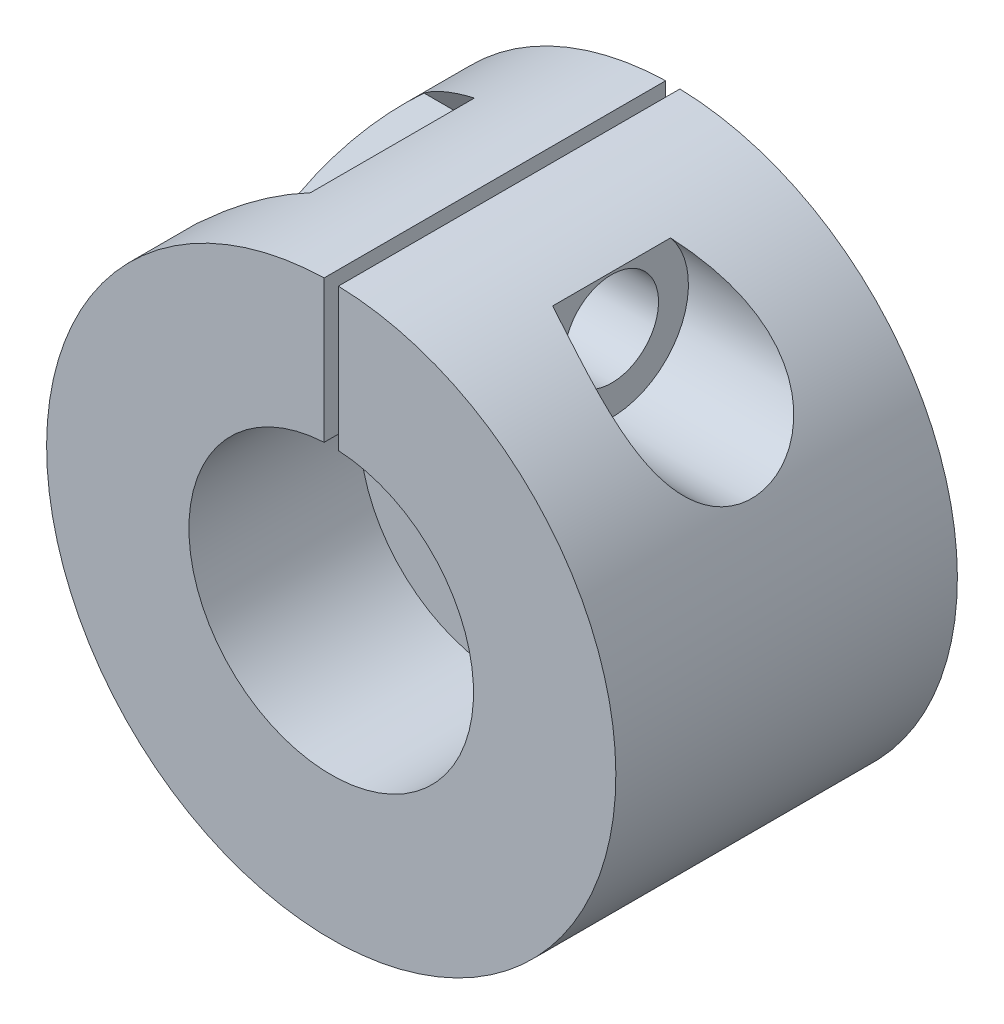
from build123d import *

# Parameters (mm, degrees)
SKETCH1_R               = 12.7
BOSS_EXTRUDE1_DEPTH     = 15.24
SKETCH2_R               = 2.9845
CUT_EXTRUDE1_DEPTH      = 7.62
SKETCH3_R               = 6.35
CUT_EXTRUDE2_DEPTH      = 7.62
CUT_EXTRUDE3_REACH      = 25.555
SKETCH7_W               = 0.635
SKETCH7_H               = 13.97
CUT_EXTRUDE4_DEPTH      = 24.727682277
CUT_EXTRUDE4_DEPTH_BACK = 24.727682277
SKETCH8_R               = 2.0955
SKETCH9_R               = 3.429
CUT_EXTRUDE5_DEPTH      = 7.62
CUT_EXTRUDE6_DEPTH      = 27.512980205


with BuildPart() as part:
    # Sketch1 → Boss-Extrude1 (new body)
    with BuildSketch(Plane.XY):
        with Locations(Location((0, 0, 0), (0, 0, 180))):
            Circle(SKETCH1_R)
    extrude(amount=BOSS_EXTRUDE1_DEPTH)

    # Sketch2 → Cut-Extrude1 (cut)
    with BuildSketch(Plane(origin=(0, 0, 0), x_dir=(-1, 0, 0), z_dir=(0, 0, -1))):
        Circle(SKETCH2_R)
    extrude(amount=-CUT_EXTRUDE1_DEPTH, mode=Mode.SUBTRACT)

    # Sketch3 → Cut-Extrude2 (cut)
    with BuildSketch(Plane.XY.offset(15.24)):
        Circle(SKETCH3_R)
    extrude(amount=-CUT_EXTRUDE2_DEPTH, mode=Mode.SUBTRACT)

    # Sketch7 → Cut-Extrude3 (cut, up to next)
    with BuildSketch(Plane(origin=(0, 0, 0), x_dir=(-1, 0, 0), z_dir=(0, 0, -1)), mode=Mode.PRIVATE) as cut_extrude3_sk1:
        with Locations((0, 6.35)):
            Rectangle(SKETCH7_W, SKETCH7_H)
    cut_extrude3_tool1 = extrude(cut_extrude3_sk1.sketch, amount=-CUT_EXTRUDE3_REACH, mode=Mode.PRIVATE) & part.part
    add(cut_extrude3_tool1.solids().sort_by_distance((0, 6.35, 0))[0], mode=Mode.SUBTRACT)

    # Sketch8 → Cut-Extrude4 (cut, two sides: drawn at the far end of the back side and taken through both)
    with BuildSketch(Plane.ZY.offset(-0.3175).offset(-CUT_EXTRUDE4_DEPTH_BACK)):
        with Locations((7.62, 9.52103063)):
            Circle(SKETCH8_R)
    extrude(amount=CUT_EXTRUDE4_DEPTH + CUT_EXTRUDE4_DEPTH_BACK, mode=Mode.SUBTRACT)

    # Sketch9 → Cut-Extrude5 (cut)
    with BuildSketch(Plane.ZY.offset(-4.8895)):
        with Locations((7.62, 9.52103063)):
            Circle(SKETCH9_R)
    extrude(amount=-CUT_EXTRUDE5_DEPTH, mode=Mode.SUBTRACT)

    # Sketch10 → Cut-Extrude6 (cut, through all)
    with BuildSketch(Plane(origin=(-4.8895, 0, 0), x_dir=(0, 0, -1), z_dir=(1, 0, 0))):
        Polygon((-10.083669069, 5.25383063), (-5.156330931, 5.25383063), (-2.692661863, 9.52103063), (-5.156330931, 13.78823063), (-10.083669069, 13.78823063), (-12.547338137, 9.52103063), align=None)
    extrude(amount=-CUT_EXTRUDE6_DEPTH, mode=Mode.SUBTRACT)


solid = part.part
